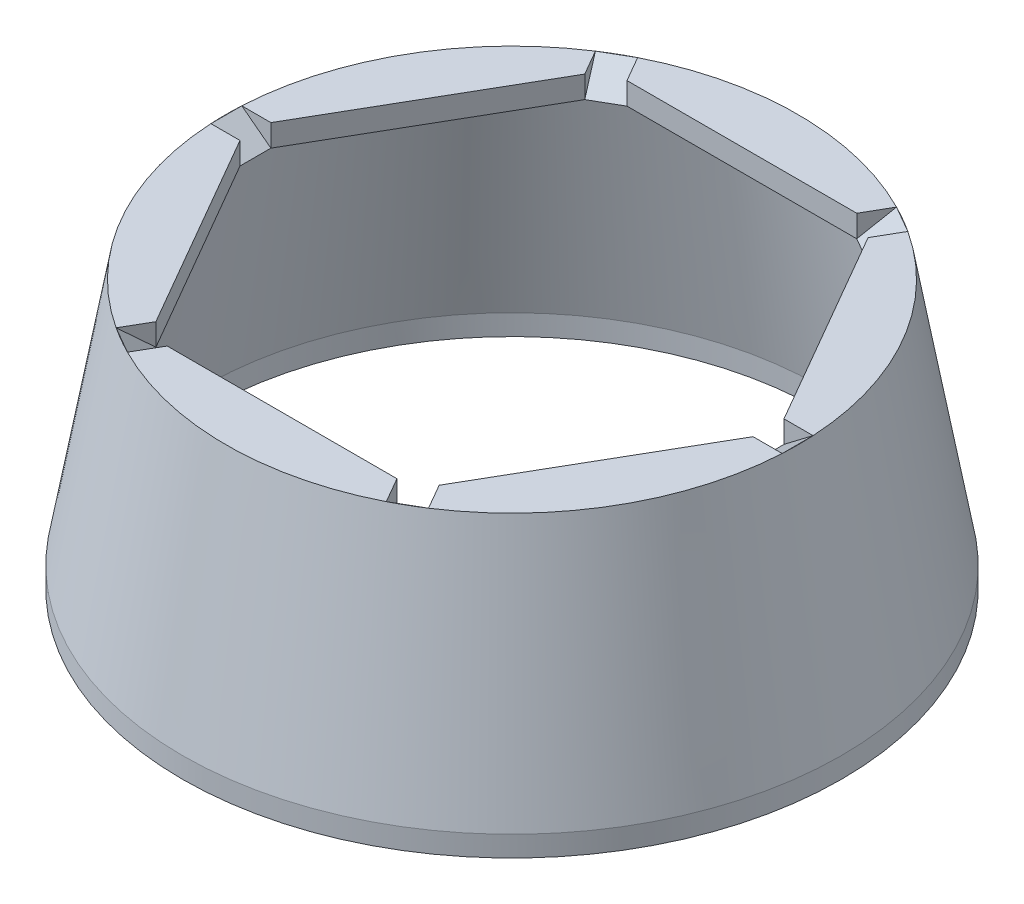
from build123d import *

# Parameters (mm, degrees)
SKETCH1_R           = 800
SKETCH1_R_2         = 750
BOSS_EXTRUDE1_DEPTH = 50
SKETCH15_R          = 694.203811575
BOSS_EXTRUDE2_DEPTH = 53.694202
SKETCH18_W          = 70.63704417
SKETCH18_H          = 75
CUT_EXTRUDE4_DEPTH  = 130
CIRPATTERN1_COUNT   = 6


with BuildPart() as part:
    # Sketch1 → Boss-Extrude1 (new body)
    with BuildSketch(Plane(origin=(0, 0, 0), x_dir=(1, 0, 0), z_dir=(0, 1, 0))):
        with Locations(Location((0, 0, 0), (0, 0, 270))):
            Circle(SKETCH1_R)
        with Locations(Location((0, 0, 0), (0, 0, 270))):
            Circle(SKETCH1_R_2, mode=Mode.SUBTRACT)
    extrude(amount=BOSS_EXTRUDE1_DEPTH)

    # Sketch14 → Revolve1 (revolve)
    with BuildSketch(Plane(origin=(0, 0, 0), x_dir=(0, 0, -1), z_dir=(1, 0, 0)), mode=Mode.PRIVATE) as revolve1_sk:
        Polygon((-644.203811575, 650), (-750, 50), (-800, 50), (-694.203811575, 650), align=None)
    revolve(revolve1_sk.sketch.rotate(Axis((0, 0, 0), (0, 1, 0)), 180), axis=Axis((0, 0, 0), (0, 1, 0)))

    # Sketch15 → Boss-Extrude2 (add)
    with BuildSketch(Plane(origin=(0, 650, 0), x_dir=(1, 0, 0), z_dir=(0, 1, 0))):
        Circle(SKETCH15_R)
        Polygon((278.800635598, 557.896866039), (343.752540882, 520.396866039), (622.55317648, 37.5), (622.55317648, -37.5), (343.752540882, -520.396866039), (278.800635598, -557.896866039), (-278.800635598, -557.896866039), (-343.752540882, -520.396866039), (-622.55317648, -37.5), (-622.55317648, 37.5), (-343.752540882, 520.396866039), (-278.800635598, 557.896866039), align=None, mode=Mode.SUBTRACT)
    extrude(amount=-BOSS_EXTRUDE2_DEPTH)

    # Sketch18 → Cut-Extrude4 (cut, along a direction that is not the sketch's normal)
    with BuildSketch(Plane(origin=(0, 650, 0), x_dir=(1, 0, 0), z_dir=(0, 1, 0))):
        with Locations((657.871698565, 0)):
            Rectangle(SKETCH18_W, SKETCH18_H)
    cut_extrude4 = extrude(amount=-CUT_EXTRUDE4_DEPTH, dir=(0.7961076341406244, 0.6051550502664734, 0), mode=Mode.SUBTRACT)

    # CirPattern1: Cut-Extrude4 ×6 about axis
    cirpattern1_axis = Axis((0, 0, 0), (0, 1, 0))
    for i in range(1, CIRPATTERN1_COUNT):
        add(cut_extrude4.rotate(cirpattern1_axis, i * 360 / CIRPATTERN1_COUNT), mode=Mode.SUBTRACT)


solid = part.part
